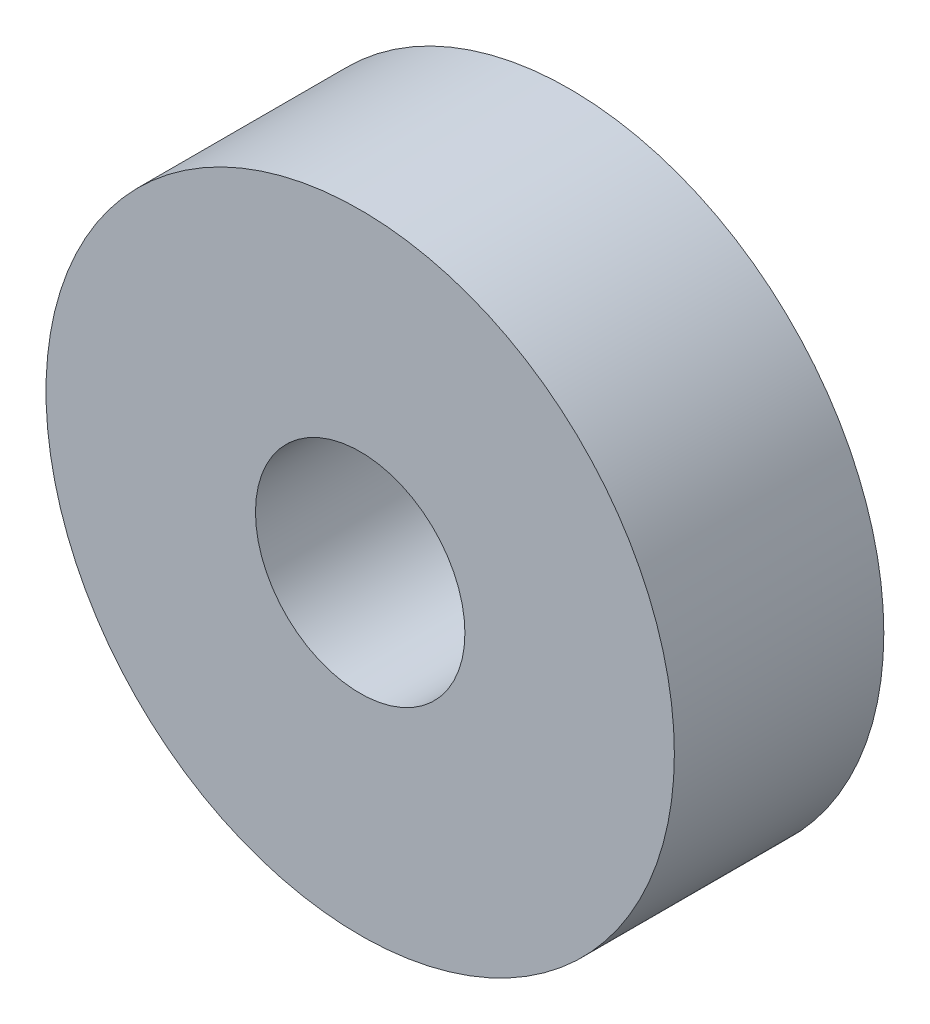
from build123d import *

# Parameters (mm, degrees)
CROQUIS1_R              = 12
CROQUIS1_R_2            = 4
SALIENTE_EXTRUIR1_DEPTH = 8


with BuildPart() as part:
    # Croquis1 → Saliente-Extruir1 (new body)
    with BuildSketch(Plane.XY):
        Circle(CROQUIS1_R)
        Circle(CROQUIS1_R_2, mode=Mode.SUBTRACT)
    extrude(amount=SALIENTE_EXTRUIR1_DEPTH)


solid = part.part
